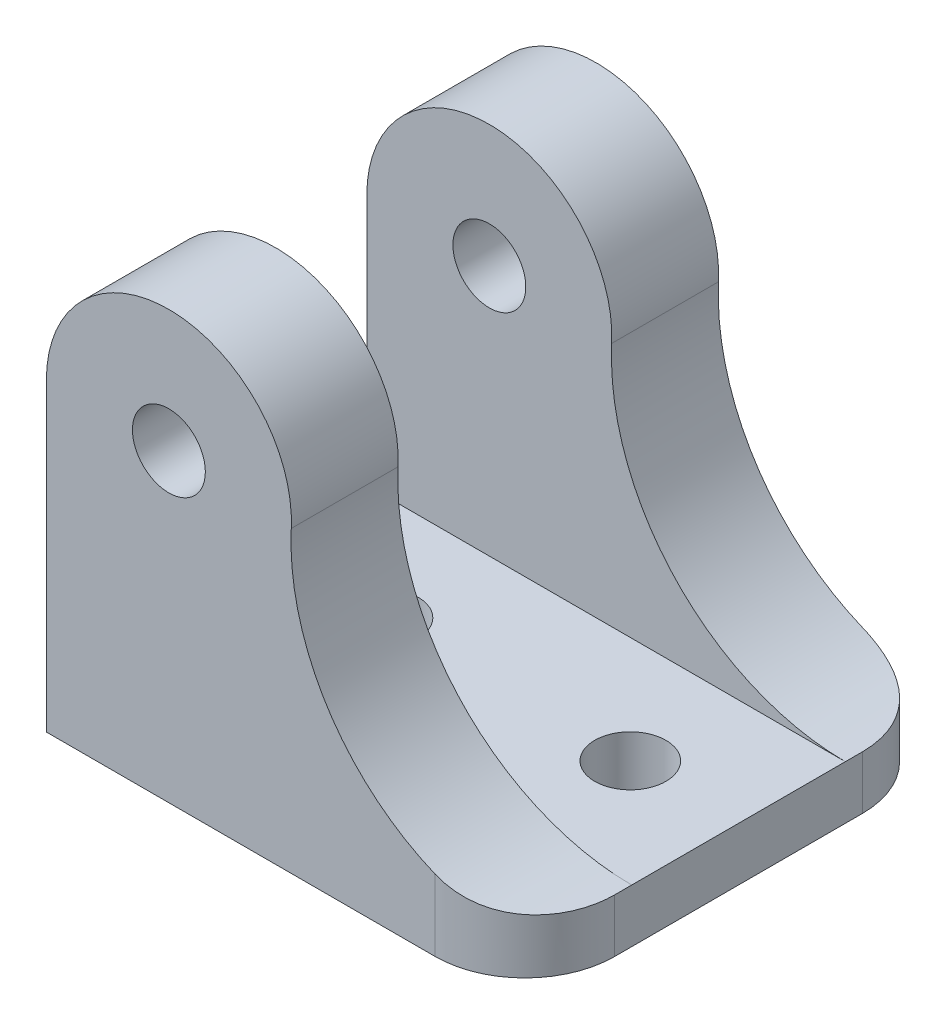
from build123d import *

# Parameters (mm, degrees)
SKETCH1_W           = 42.672
SKETCH1_H           = 38.1
BOSS_EXTRUDE1_DEPTH = 4.7625
SKETCH2_R           = 3.25
BOSS_EXTRUDE2_DEPTH = 9.525
SKETCH3_R           = 3.175
CUT_EXTRUDE1_DEPTH  = 9.525
FILLET1_R           = 8


with BuildPart() as part:
    # Sketch1 → Boss-Extrude1 (new body)
    with BuildSketch(Plane(origin=(0, 0, 0), x_dir=(1, 0, 0), z_dir=(0, 1, 0))):
        Rectangle(SKETCH1_W, SKETCH1_H)
    extrude(amount=BOSS_EXTRUDE1_DEPTH)

    # Sketch2 → Boss-Extrude2 (add)
    with BuildSketch(Plane.XY.offset(19.05)):
        with BuildLine():
            Line((-21.336, 4.7625), (-21.336, 27.178))
            ThreePointArc((-21.336, 27.178), (-10.143235589, 38.1), (0.501451896, 26.643181614))
            ThreePointArc((0.501451896, 26.643181614), (6.229357234, 11.237674696), (21.336, 4.7625))
            Line((21.336, 4.7625), (-21.336, 4.7625))
        make_face()
        with Locations((-10.410724966, 27.178)):
            Circle(SKETCH2_R, mode=Mode.SUBTRACT)
    boss_extrude2 = extrude(amount=-BOSS_EXTRUDE2_DEPTH)

    # Mirror1: Boss-Extrude2 across plane
    add(boss_extrude2.mirror(Plane.XY))

    # Sketch3 → Cut-Extrude1 (cut)
    with BuildSketch(Plane(origin=(0, 4.7625, 0), x_dir=(1, 0, 0), z_dir=(0, 1, 0))):
        with Locations(Location((-10.414, 0, 0), (0, 0, 270))):
            Circle(SKETCH3_R)
        with Locations(Location((11.684, 0, 0), (0, 0, 270))):
            Circle(SKETCH3_R)
    extrude(amount=-CUT_EXTRUDE1_DEPTH, mode=Mode.SUBTRACT)

    # Fillet1
    fillet1_edges = [part.edges().sort_by_distance(p)[0] for p in [
        (21.336, 2.38125, -19.05),
        (21.336, 2.38125, 19.05),
    ]]
    fillet(fillet1_edges, radius=FILLET1_R)


solid = part.part
